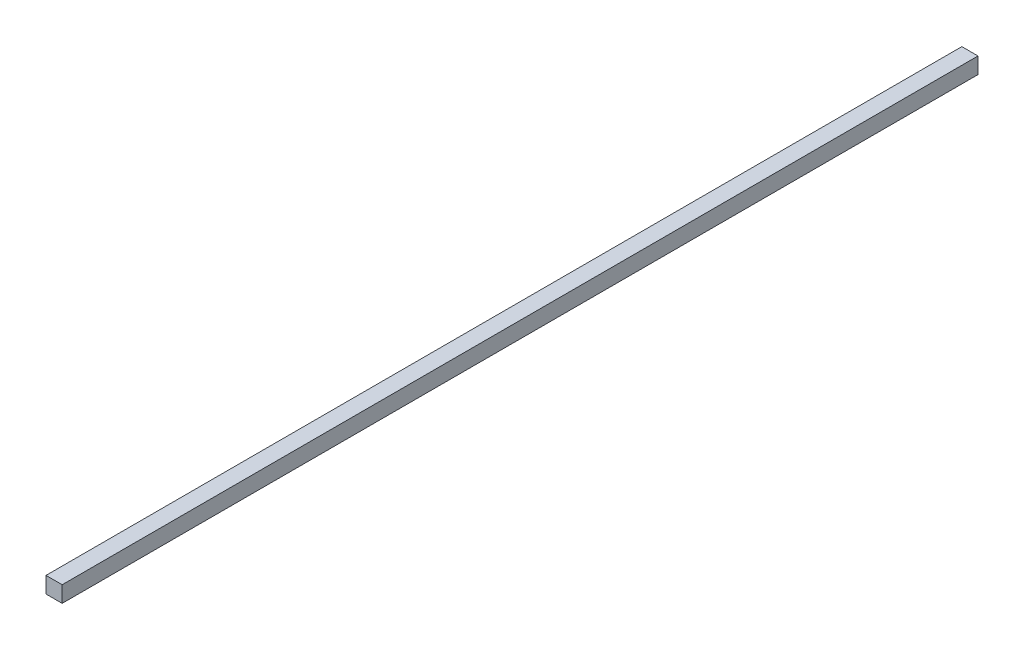
from build123d import *

# Parameters (mm, degrees)
SKETCH_1_W      = 15
SKETCH_1_H      = 15
EXTRUDE_1_DEPTH = 850


with BuildPart() as part:
    # 草图1 → 凸台-拉伸1 (new body)
    with BuildSketch(Plane.XY):
        with Locations((7.5, 7.5)):
            Rectangle(SKETCH_1_W, SKETCH_1_H)
    extrude(amount=EXTRUDE_1_DEPTH)


solid = part.part
